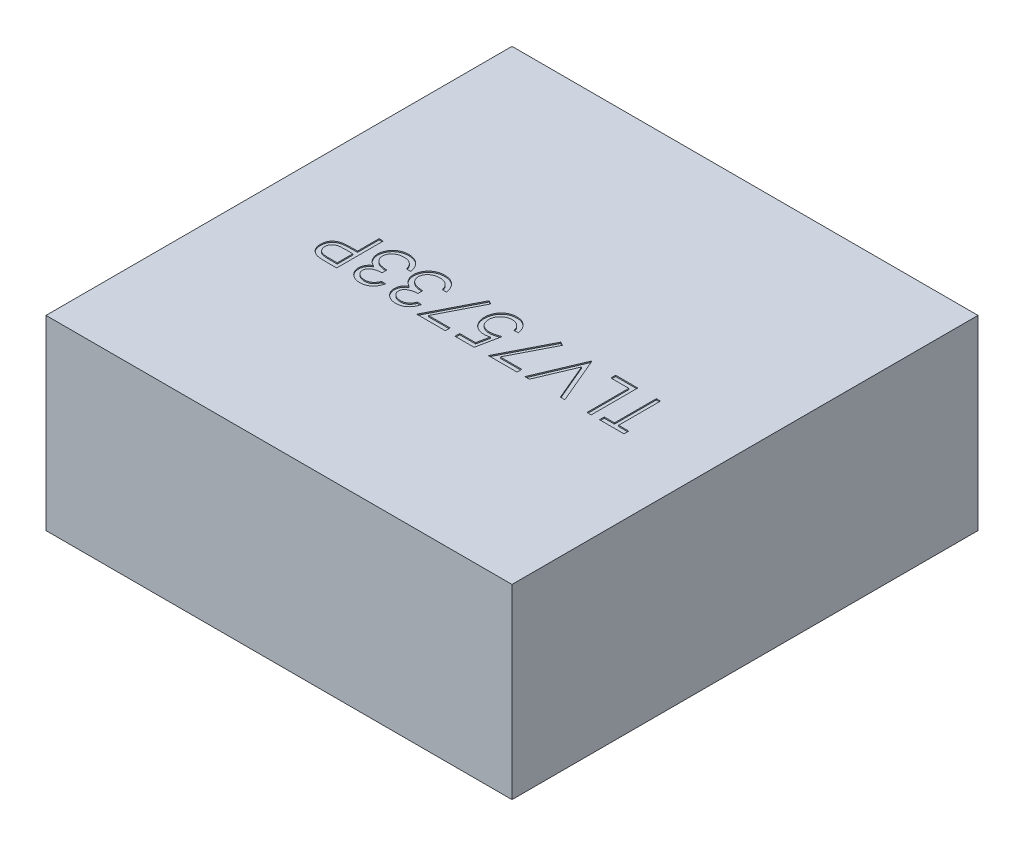
from build123d import *

# Parameters (mm, degrees)
BASES_W          = 2
BASES_H          = 2
BASE_DEPTH       = 0.8
PARTNUMBER_DEPTH = 0.005


with BuildPart() as part:
    # BaseS → Base (new body)
    with BuildSketch(Plane(origin=(0, 0, 0), x_dir=(1, 0, 0), z_dir=(0, 1, 0))):
        Rectangle(BASES_W, BASES_H)
    extrude(amount=BASE_DEPTH)

    # PartNumberS → PartNumber (cut)
    # profile 1 of 9: a face of its own
    with BuildSketch(Plane(origin=(0, 0.8, 0), x_dir=(1, 0, 0), z_dir=(0, 1, 0))):
        Polygon((0.680769231, -0.179487179), (0.680769231, -0.2), (0.575641026, -0.2), (0.575641026, -0.179487179), (0.619230769, -0.179487179), (0.619230769, 0), (0.637179487, 0), (0.637179487, -0.179487179), align=None)
    # profile 2 of 9: a face of its own
    with BuildSketch(Plane(origin=(0, 0.8, 0), x_dir=(1, 0, 0), z_dir=(0, 1, 0))):
        Polygon((0.53974359, -0.2), (0.521794872, -0.2), (0.521794872, -0.020512821), (0.444871795, -0.020512821), (0.444871795, 0), (0.53974359, 0), align=None)
    # profile 3 of 9: a face of its own
    with BuildSketch(Plane(origin=(0, 0.8, 0), x_dir=(1, 0, 0), z_dir=(0, 1, 0))):
        Polygon((0.426923077, -0.2), (0.407692308, -0.2), (0.341025641, -0.042387821), (0.274358974, -0.2), (0.255128205, -0.2), (0.33974359, 0), (0.342307692, 0), align=None)
    # profile 4 of 9: a face of its own
    with BuildSketch(Plane(origin=(0, 0.8, 0), x_dir=(1, 0, 0), z_dir=(0, 1, 0))):
        Polygon((0.221794872, -0.2), (0.098717949, -0.2), (0.203846154, 0.005128205), (0.219350962, -0.003405449), (0.129086538, -0.179487179), (0.221794872, -0.179487179), align=None)
    # profile 5 of 9: a face of its own
    with BuildSketch(Plane(origin=(0, 0.8, 0), x_dir=(1, 0, 0), z_dir=(0, 1, 0))):
        with BuildLine():
            Line((-0.044871795, -0.2), (-0.044871795, -0.179487179))
            Line((-0.044871795, -0.179487179), (0.023157051, -0.179487179))
            Line((0.023157051, -0.179487179), (0.033934295, -0.126883013))
            add(Edge.make_bspline(
                [(0.033934295, -0.126883013), (0.031816816, -0.1274676), (0.027714537, -0.128600145), (0.021659687, -0.129857617), (0.015911561, -0.130615643), (0.01218154, -0.130719146), (0.010376603, -0.130769231)],
                knots=[0, 0, 0, 0, 1.100273476, 2.13160584, 3.095893838, 4, 4, 4, 4], degree=3))
            add(Edge.make_bspline(
                [(0.010376603, -0.130769231), (0.008142844, -0.130722475), (0.003750716, -0.130630542), (-0.00266564, -0.129695799), (-0.00882109, -0.128340984), (-0.014627096, -0.126257022), (-0.020177264, -0.12369573), (-0.025396346, -0.120511598), (-0.030308859, -0.116749998), (-0.034904064, -0.112488094), (-0.039046803, -0.107742932), (-0.04266112, -0.102636713), (-0.045750495, -0.097226416), (-0.048214901, -0.091462275), (-0.050212995, -0.085398611), (-0.051534137, -0.078984544), (-0.052415598, -0.072273437), (-0.05251395, -0.067684575), (-0.052564103, -0.065344551)],
                knots=[0, 0, 0, 0, 1.052656913, 2.069786496, 3.052102726, 4.020122636, 4.972424848, 5.930457368, 6.896570172, 7.885826804, 8.881139003, 9.861434336, 10.831623367, 11.813212553, 12.812997731, 13.836986694, 14.897002833, 16, 16, 16, 16], degree=3))
            add(Edge.make_bspline(
                [(-0.052564103, -0.065344551), (-0.052526069, -0.063714718), (-0.052450516, -0.060477078), (-0.052067024, -0.05566872), (-0.051326252, -0.050962711), (-0.050342361, -0.046368373), (-0.049034062, -0.041878849), (-0.047486935, -0.037483546), (-0.045635127, -0.033189737), (-0.043521961, -0.029018787), (-0.041117733, -0.02505279), (-0.038551881, -0.021245534), (-0.035755993, -0.017707472), (-0.032779013, -0.014379465), (-0.029563779, -0.011357231), (-0.026189195, -0.008514697), (-0.022579797, -0.005972433), (-0.018799216, -0.00363428), (-0.014850105, -0.001540748), (-0.010692348, 0.000205622), (-0.006417238, 0.001736333), (-0.001986665, 0.002981114), (0.002590784, 0.003946885), (0.007330874, 0.004604561), (0.01220982, 0.005083078), (0.015516956, 0.00511306), (0.0171875, 0.005128205)],
                knots=[0, 0, 0, 0, 1.056281413, 2.098288097, 3.122646807, 4.141030392, 5.140675379, 6.150604744, 7.15845591, 8.168533554, 9.177684096, 10.161739049, 11.141561652, 12.097360316, 13.052218386, 13.998410789, 14.954052752, 15.909851415, 16.877523809, 17.846742625, 18.829312613, 19.818263486, 20.826374662, 21.858017533, 22.918014209, 24, 24, 24, 24], degree=3))
            add(Edge.make_bspline(
                [(0.0171875, 0.005128205), (0.019180257, 0.005088619), (0.023100771, 0.005010738), (0.028845563, 0.004199816), (0.034369338, 0.003030456), (0.039649185, 0.001298915), (0.044660275, -0.000971722), (0.049475299, -0.003652227), (0.054006118, -0.006887491), (0.058284876, -0.010561531), (0.062209915, -0.014636501), (0.065823355, -0.018968808), (0.068952141, -0.023654541), (0.071670748, -0.028615525), (0.073983404, -0.033864696), (0.075801821, -0.039414236), (0.077269041, -0.045237188), (0.077889824, -0.049245947), (0.078205128, -0.051282051)],
                knots=[0, 0, 0, 0, 1.04695683, 2.059763882, 3.044413726, 4.012427942, 4.974081556, 5.932886124, 6.904940154, 7.895678616, 8.893654631, 9.876199664, 10.857615262, 11.850515636, 12.847107701, 13.868396357, 14.917328757, 16, 16, 16, 16], degree=3))
            Line((0.078205128, -0.051282051), (0.06025641, -0.051282051))
            add(Edge.make_bspline(
                [(0.06025641, -0.051282051), (0.059815333, -0.049374443), (0.058967558, -0.045707913), (0.057096993, -0.040562644), (0.054846086, -0.03595852), (0.052045418, -0.031924495), (0.04886416, -0.028324783), (0.045192472, -0.025123656), (0.041061558, -0.022270508), (0.036470494, -0.019872837), (0.031614568, -0.017856105), (0.026561981, -0.016416181), (0.021384479, -0.015544733), (0.017898621, -0.015438189), (0.016145833, -0.015384615)],
                knots=[0, 0, 0, 0, 1.136370375, 2.184166959, 3.172867797, 4.104539607, 5.027679118, 5.956634301, 6.927059835, 7.936867459, 8.959641981, 9.976160943, 10.98235693, 12, 12, 12, 12], degree=3))
            add(Edge.make_bspline(
                [(0.016145833, -0.015384615), (0.014434067, -0.015431909), (0.011063586, -0.015525032), (0.006100853, -0.016230204), (0.001323524, -0.017344777), (-0.00327688, -0.01890623), (-0.007677755, -0.02097194), (-0.011872877, -0.023509547), (-0.01592201, -0.026455739), (-0.019718587, -0.029823128), (-0.023194943, -0.033536101), (-0.026266769, -0.037506128), (-0.028825438, -0.041741405), (-0.030981676, -0.046168435), (-0.032619006, -0.050835783), (-0.033787063, -0.055721564), (-0.034472952, -0.060837848), (-0.034567305, -0.064327523), (-0.034615385, -0.066105769)],
                knots=[0, 0, 0, 0, 1.027268864, 2.022700798, 3.002744649, 3.968653148, 4.933396556, 5.915045722, 6.907600446, 7.935526002, 8.956456544, 9.95700807, 10.942805781, 11.92166854, 12.907987664, 13.905483474, 14.932689774, 16, 16, 16, 16], degree=3))
            add(Edge.make_bspline(
                [(-0.034615385, -0.066105769), (-0.034584995, -0.067711261), (-0.034525727, -0.070842346), (-0.033824813, -0.075418974), (-0.032880736, -0.079787618), (-0.031391757, -0.08390746), (-0.029583182, -0.087821511), (-0.027226683, -0.091433059), (-0.024621421, -0.094918694), (-0.021501441, -0.098047976), (-0.018123222, -0.100960292), (-0.014379546, -0.103430346), (-0.010377398, -0.105531902), (-0.006107453, -0.107253498), (-0.00156497, -0.108624951), (0.003252642, -0.109572763), (0.00834644, -0.110139924), (0.011830763, -0.110216862), (0.013621795, -0.11025641)],
                knots=[0, 0, 0, 0, 1.045820996, 2.039596555, 3.013371638, 3.9552447, 4.890047302, 5.817684688, 6.761648481, 7.722253242, 8.692244539, 9.66551337, 10.63924952, 11.635311376, 12.662847378, 13.728455105, 14.832366986, 16, 16, 16, 16], degree=3))
            add(Edge.make_bspline(
                [(0.013621795, -0.11025641), (0.015185482, -0.11022436), (0.018386592, -0.110158749), (0.023308293, -0.109642401), (0.028457756, -0.108848049), (0.033854972, -0.107703134), (0.03948513, -0.106269622), (0.045357593, -0.104479345), (0.051472502, -0.102417172), (0.055588274, -0.10081768), (0.057692308, -0.1)],
                knots=[0, 0, 0, 0, 0.824638674, 1.688163388, 2.607705698, 3.571998603, 4.597075385, 5.671199175, 6.809488238, 8, 8, 8, 8], degree=3))
            Line((0.057692308, -0.1), (0.037179487, -0.2))
            Line((0.037179487, -0.2), (-0.044871795, -0.2))
        make_face()
    # profile 6 of 9: a face of its own
    with BuildSketch(Plane(origin=(0, 0.8, 0), x_dir=(1, 0, 0), z_dir=(0, 1, 0))):
        Polygon((-0.085897436, -0.2), (-0.208974359, -0.2), (-0.103846154, 0.005128205), (-0.088341346, -0.003405449), (-0.178605769, -0.179487179), (-0.085897436, -0.179487179), align=None)
    # profile 7 of 9: a face of its own
    with BuildSketch(Plane(origin=(0, 0.8, 0), x_dir=(1, 0, 0), z_dir=(0, 1, 0))):
        with BuildLine():
            Line((-0.252564103, -0.153846154), (-0.234615385, -0.153846154))
            add(Edge.make_bspline(
                [(-0.234615385, -0.153846154), (-0.235101645, -0.155859439), (-0.236052243, -0.159795246), (-0.238034962, -0.165418518), (-0.240194919, -0.170739862), (-0.242788582, -0.175659638), (-0.245617654, -0.180276718), (-0.248858952, -0.184486382), (-0.252362936, -0.188395694), (-0.256238648, -0.191865022), (-0.260303143, -0.195006607), (-0.264613693, -0.197685181), (-0.269083572, -0.199989419), (-0.273743751, -0.201887718), (-0.278608104, -0.203317748), (-0.283632654, -0.204355279), (-0.288830568, -0.205029057), (-0.292359002, -0.205094815), (-0.294150641, -0.205128205)],
                knots=[0, 0, 0, 0, 1.162005537, 2.271625781, 3.343758855, 4.383309926, 5.390229558, 6.379919256, 7.361854164, 8.333198761, 9.295911338, 10.242430842, 11.177959212, 12.116337295, 13.062827104, 14.020064771, 14.994644689, 16, 16, 16, 16], degree=3))
            add(Edge.make_bspline(
                [(-0.294150641, -0.205128205), (-0.296761083, -0.205049392), (-0.301925027, -0.204893485), (-0.309511487, -0.203469803), (-0.316827305, -0.201216938), (-0.323792405, -0.198104154), (-0.33026203, -0.194264879), (-0.336018383, -0.189695465), (-0.340983441, -0.184484076), (-0.345148834, -0.17872793), (-0.348410262, -0.172576186), (-0.350815198, -0.166244749), (-0.352279294, -0.159748636), (-0.35246904, -0.155362506), (-0.352564103, -0.153165064)],
                knots=[0, 0, 0, 0, 1.083050992, 2.142477498, 3.193116406, 4.255571735, 5.30263384, 6.308962982, 7.297363603, 8.282367274, 9.249857812, 10.179914175, 11.08814088, 12, 12, 12, 12], degree=3))
            add(Edge.make_bspline(
                [(-0.352564103, -0.153165064), (-0.352497612, -0.15105039), (-0.352367499, -0.146912301), (-0.351262716, -0.140871073), (-0.349403501, -0.135177267), (-0.346828086, -0.129806915), (-0.343494283, -0.124794067), (-0.339455843, -0.120127445), (-0.334684263, -0.11578635), (-0.331068323, -0.113299523), (-0.329206731, -0.112019231)],
                knots=[0, 0, 0, 0, 1.024540389, 2.004866551, 2.965041327, 3.920577974, 4.882998113, 5.874504559, 6.905732034, 8, 8, 8, 8], degree=3))
            add(Edge.make_bspline(
                [(-0.329206731, -0.112019231), (-0.331336971, -0.110995631), (-0.335564434, -0.108964297), (-0.341268516, -0.104917242), (-0.346525572, -0.100359254), (-0.349422874, -0.096762548), (-0.35088141, -0.094951923)],
                knots=[0, 0, 0, 0, 1.015663554, 2.015584519, 3.001021554, 4, 4, 4, 4], degree=3))
            add(Edge.make_bspline(
                [(-0.35088141, -0.094951923), (-0.351844164, -0.093634478), (-0.353753907, -0.091021161), (-0.3561045, -0.086817028), (-0.358261328, -0.082580215), (-0.35984869, -0.078144135), (-0.361218522, -0.073651284), (-0.362119825, -0.069005451), (-0.362698426, -0.064250776), (-0.362779673, -0.061032679), (-0.362820513, -0.059415064)],
                knots=[0, 0, 0, 0, 1.02516404, 2.033540309, 3.025129118, 4.011046665, 4.991655828, 5.976607087, 6.982917762, 8, 8, 8, 8], degree=3))
            add(Edge.make_bspline(
                [(-0.362820513, -0.059415064), (-0.362717729, -0.056614634), (-0.362512644, -0.051026954), (-0.360687448, -0.04276937), (-0.357840373, -0.034712452), (-0.353872501, -0.026970463), (-0.348941038, -0.019748905), (-0.343106446, -0.013268976), (-0.336362512, -0.007749819), (-0.328905592, -0.003097513), (-0.320795508, 0.000589387), (-0.312155603, 0.003246097), (-0.30303703, 0.00483975), (-0.29680125, 0.005030959), (-0.293629808, 0.005128205)],
                knots=[0, 0, 0, 0, 0.955619592, 1.906742024, 2.874954321, 3.868585453, 4.869520953, 5.854611167, 6.836527075, 7.836578462, 8.849204403, 9.870874567, 10.917152508, 12, 12, 12, 12], degree=3))
            add(Edge.make_bspline(
                [(-0.293629808, 0.005128205), (-0.291491697, 0.00507816), (-0.287284607, 0.004979689), (-0.281097347, 0.004318503), (-0.275203834, 0.003078069), (-0.269546838, 0.001518053), (-0.264211739, -0.000638844), (-0.259121794, -0.003210266), (-0.254299316, -0.006262151), (-0.249772943, -0.009799634), (-0.245547511, -0.013759317), (-0.241730671, -0.018206982), (-0.238280192, -0.023059619), (-0.235218, -0.02836088), (-0.232531206, -0.034095915), (-0.23027763, -0.040287707), (-0.228309979, -0.046888254), (-0.227393366, -0.051486777), (-0.226923077, -0.053846154)],
                knots=[0, 0, 0, 0, 1.048603596, 2.063302207, 3.045874044, 3.999447474, 4.937100059, 5.862643889, 6.7929026, 7.7308982, 8.676022965, 9.627908155, 10.600123445, 11.591992905, 12.626222643, 13.701663232, 14.820785756, 16, 16, 16, 16], degree=3))
            Line((-0.226923077, -0.053846154), (-0.244871795, -0.053846154))
            add(Edge.make_bspline(
                [(-0.244871795, -0.053846154), (-0.245339412, -0.05230621), (-0.246248967, -0.049310886), (-0.247797212, -0.045000012), (-0.249561113, -0.041048123), (-0.251453374, -0.03742623), (-0.253440714, -0.034098664), (-0.255664424, -0.031153415), (-0.257959803, -0.028461117), (-0.259690052, -0.026944282), (-0.260536859, -0.026201923)],
                knots=[0, 0, 0, 0, 1.198163088, 2.33053128, 3.407730985, 4.417276592, 5.372219308, 6.28897303, 7.162600585, 8, 8, 8, 8], degree=3))
            add(Edge.make_bspline(
                [(-0.260536859, -0.026201923), (-0.261656788, -0.025338946), (-0.26389319, -0.023615655), (-0.267535212, -0.021410219), (-0.271378905, -0.019522419), (-0.275456321, -0.017987935), (-0.27976801, -0.016836097), (-0.284296479, -0.016007058), (-0.28904916, -0.015459763), (-0.292292772, -0.01541003), (-0.293950321, -0.015384615)],
                knots=[0, 0, 0, 0, 0.946083416, 1.889246487, 2.84504177, 3.809995578, 4.801312957, 5.829064617, 6.89060985, 8, 8, 8, 8], degree=3))
            add(Edge.make_bspline(
                [(-0.293950321, -0.015384615), (-0.295821975, -0.015419753), (-0.299481833, -0.015488461), (-0.304821756, -0.016122158), (-0.309903447, -0.017041039), (-0.314675045, -0.018478347), (-0.319201481, -0.020202635), (-0.323381711, -0.022460045), (-0.32733863, -0.025009425), (-0.330956317, -0.027974844), (-0.334217839, -0.031180141), (-0.337036154, -0.034580675), (-0.339477138, -0.038071008), (-0.341439281, -0.041732562), (-0.342991429, -0.045529421), (-0.344047428, -0.049475795), (-0.344781849, -0.053538455), (-0.344841649, -0.056300116), (-0.344871795, -0.057692308)],
                knots=[0, 0, 0, 0, 1.216990249, 2.379719373, 3.493992396, 4.571561497, 5.616923107, 6.638958652, 7.655775068, 8.674704564, 9.676001865, 10.625896028, 11.54399481, 12.441854662, 13.322657739, 14.20572845, 15.095482574, 16, 16, 16, 16], degree=3))
            add(Edge.make_bspline(
                [(-0.344871795, -0.057692308), (-0.344784167, -0.059555696), (-0.344609346, -0.0632732), (-0.34328016, -0.068744529), (-0.341074286, -0.074018171), (-0.338046202, -0.079025064), (-0.334271747, -0.083611196), (-0.32992934, -0.08771628), (-0.324926328, -0.091134393), (-0.32029549, -0.093489428), (-0.316182981, -0.095058495), (-0.31267069, -0.096158774), (-0.308735058, -0.097038296), (-0.304423376, -0.097889066), (-0.299717445, -0.098602295), (-0.29461303, -0.099199653), (-0.289108075, -0.099676883), (-0.285297159, -0.099890117), (-0.283333333, -0.1)],
                knots=[0, 0, 0, 0, 1.070440979, 2.135555593, 3.216243406, 4.345886539, 5.486149072, 6.621334998, 7.769144672, 8.957074012, 9.598644492, 10.297969361, 11.070758978, 11.915404831, 12.824182859, 13.805940418, 14.869366021, 16, 16, 16, 16], degree=3))
            Line((-0.283333333, -0.1), (-0.283333333, -0.120512821))
            add(Edge.make_bspline(
                [(-0.283333333, -0.120512821), (-0.285806723, -0.120561043), (-0.290649793, -0.120655467), (-0.297744165, -0.12156233), (-0.304507319, -0.123034295), (-0.310837527, -0.125089351), (-0.316577441, -0.127591218), (-0.321604791, -0.130392354), (-0.325738717, -0.133623909), (-0.329053258, -0.137133123), (-0.33151169, -0.140920736), (-0.333326358, -0.144850479), (-0.334399697, -0.148995461), (-0.334543235, -0.151823627), (-0.334615385, -0.153245192)],
                knots=[0, 0, 0, 0, 1.321816535, 2.58820849, 3.816448615, 5.017641336, 6.139869627, 7.160068286, 8.085608132, 8.934319198, 9.728416342, 10.48890201, 11.240453369, 12, 12, 12, 12], degree=3))
            add(Edge.make_bspline(
                [(-0.334615385, -0.153245192), (-0.334592225, -0.154289811), (-0.33454615, -0.156368031), (-0.333941878, -0.159413745), (-0.333075802, -0.162366392), (-0.331817567, -0.165191473), (-0.330190288, -0.167897968), (-0.328221523, -0.170495763), (-0.325906283, -0.173009663), (-0.323259606, -0.175384225), (-0.320305845, -0.177521373), (-0.317163555, -0.179426611), (-0.313820484, -0.181028645), (-0.310298418, -0.182356622), (-0.30657832, -0.183353822), (-0.302679758, -0.184070288), (-0.29859472, -0.184518117), (-0.295807768, -0.184582603), (-0.294391026, -0.184615385)],
                knots=[0, 0, 0, 0, 0.884246871, 1.759167212, 2.622361933, 3.489113179, 4.372562419, 5.294145153, 6.247651513, 7.265905295, 8.30305477, 9.334068495, 10.37719476, 11.441246459, 12.52060732, 13.637552802, 14.799054011, 16, 16, 16, 16], degree=3))
            add(Edge.make_bspline(
                [(-0.294391026, -0.184615385), (-0.292113712, -0.184536032), (-0.287665589, -0.184381039), (-0.281254357, -0.183018718), (-0.275300401, -0.180860261), (-0.270764688, -0.178253931), (-0.267409674, -0.17569), (-0.264966247, -0.17348425), (-0.262610533, -0.170983381), (-0.260434973, -0.168118798), (-0.258309201, -0.164989002), (-0.256253517, -0.161576754), (-0.254333949, -0.157833407), (-0.253165476, -0.155200978), (-0.252564103, -0.153846154)],
                knots=[0, 0, 0, 0, 1.4727372, 2.876598283, 4.222346151, 5.558423782, 6.24313385, 6.953189256, 7.68715613, 8.463578749, 9.278833271, 10.135787152, 11.040551781, 12, 12, 12, 12], degree=3))
        make_face()
    # profile 8 of 9: a face of its own
    with BuildSketch(Plane(origin=(0, 0.8, 0), x_dir=(1, 0, 0), z_dir=(0, 1, 0))):
        with BuildLine():
            Line((-0.406410256, -0.153846154), (-0.388461538, -0.153846154))
            add(Edge.make_bspline(
                [(-0.388461538, -0.153846154), (-0.388947799, -0.155859439), (-0.389898397, -0.159795246), (-0.391881116, -0.165418518), (-0.394041073, -0.170739862), (-0.396634736, -0.175659638), (-0.399463808, -0.180276718), (-0.402705106, -0.184486382), (-0.40620909, -0.188395694), (-0.410084802, -0.191865022), (-0.414149297, -0.195006607), (-0.418459846, -0.197685181), (-0.422929726, -0.199989419), (-0.427589905, -0.201887718), (-0.432454258, -0.203317748), (-0.437478808, -0.204355279), (-0.442676722, -0.205029057), (-0.446205156, -0.205094815), (-0.447996795, -0.205128205)],
                knots=[0, 0, 0, 0, 1.162005537, 2.271625781, 3.343758855, 4.383309926, 5.390229558, 6.379919256, 7.361854164, 8.333198761, 9.295911338, 10.242430842, 11.177959212, 12.116337295, 13.062827104, 14.020064771, 14.994644689, 16, 16, 16, 16], degree=3))
            add(Edge.make_bspline(
                [(-0.447996795, -0.205128205), (-0.450607237, -0.205049392), (-0.455771181, -0.204893485), (-0.463357641, -0.203469803), (-0.470673459, -0.201216938), (-0.477638559, -0.198104154), (-0.484108183, -0.194264879), (-0.489864537, -0.189695465), (-0.494829595, -0.184484076), (-0.498994988, -0.17872793), (-0.502256416, -0.172576186), (-0.504661352, -0.166244749), (-0.506125448, -0.159748636), (-0.506315194, -0.155362506), (-0.506410256, -0.153165064)],
                knots=[0, 0, 0, 0, 1.083050992, 2.142477498, 3.193116406, 4.255571735, 5.30263384, 6.308962982, 7.297363603, 8.282367274, 9.249857812, 10.179914175, 11.08814088, 12, 12, 12, 12], degree=3))
            add(Edge.make_bspline(
                [(-0.506410256, -0.153165064), (-0.506343765, -0.15105039), (-0.506213653, -0.146912301), (-0.50510887, -0.140871073), (-0.503249655, -0.135177267), (-0.50067424, -0.129806915), (-0.497340437, -0.124794067), (-0.493301997, -0.120127445), (-0.488530417, -0.11578635), (-0.484914477, -0.113299523), (-0.483052885, -0.112019231)],
                knots=[0, 0, 0, 0, 1.024540389, 2.004866551, 2.965041327, 3.920577974, 4.882998113, 5.874504559, 6.905732034, 8, 8, 8, 8], degree=3))
            add(Edge.make_bspline(
                [(-0.483052885, -0.112019231), (-0.485183125, -0.110995631), (-0.489410588, -0.108964297), (-0.49511467, -0.104917242), (-0.500371726, -0.100359254), (-0.503269028, -0.096762548), (-0.504727564, -0.094951923)],
                knots=[0, 0, 0, 0, 1.015663554, 2.015584519, 3.001021554, 4, 4, 4, 4], degree=3))
            add(Edge.make_bspline(
                [(-0.504727564, -0.094951923), (-0.505690318, -0.093634478), (-0.507600061, -0.091021161), (-0.509950654, -0.086817028), (-0.512107482, -0.082580215), (-0.513694844, -0.078144135), (-0.515064675, -0.073651284), (-0.515965979, -0.069005451), (-0.516544579, -0.064250776), (-0.516625827, -0.061032679), (-0.516666667, -0.059415064)],
                knots=[0, 0, 0, 0, 1.02516404, 2.033540309, 3.025129118, 4.011046665, 4.991655828, 5.976607087, 6.982917762, 8, 8, 8, 8], degree=3))
            add(Edge.make_bspline(
                [(-0.516666667, -0.059415064), (-0.516563882, -0.056614634), (-0.516358798, -0.051026954), (-0.514533602, -0.04276937), (-0.511686526, -0.034712452), (-0.507718655, -0.026970463), (-0.502787192, -0.019748905), (-0.496952599, -0.013268976), (-0.490208666, -0.007749819), (-0.482751746, -0.003097513), (-0.474641662, 0.000589387), (-0.466001757, 0.003246097), (-0.456883184, 0.00483975), (-0.450647404, 0.005030959), (-0.447475962, 0.005128205)],
                knots=[0, 0, 0, 0, 0.955619592, 1.906742024, 2.874954321, 3.868585453, 4.869520953, 5.854611167, 6.836527075, 7.836578462, 8.849204403, 9.870874567, 10.917152508, 12, 12, 12, 12], degree=3))
            add(Edge.make_bspline(
                [(-0.447475962, 0.005128205), (-0.44533785, 0.00507816), (-0.441130761, 0.004979689), (-0.434943501, 0.004318503), (-0.429049988, 0.003078069), (-0.423392992, 0.001518053), (-0.418057892, -0.000638844), (-0.412967948, -0.003210266), (-0.40814547, -0.006262151), (-0.403619097, -0.009799634), (-0.399393665, -0.013759317), (-0.395576825, -0.018206982), (-0.392126346, -0.023059619), (-0.389064154, -0.02836088), (-0.386377359, -0.034095915), (-0.384123783, -0.040287707), (-0.382156133, -0.046888254), (-0.38123952, -0.051486777), (-0.380769231, -0.053846154)],
                knots=[0, 0, 0, 0, 1.048603596, 2.063302207, 3.045874044, 3.999447474, 4.937100059, 5.862643889, 6.7929026, 7.7308982, 8.676022965, 9.627908155, 10.600123445, 11.591992905, 12.626222643, 13.701663232, 14.820785756, 16, 16, 16, 16], degree=3))
            Line((-0.380769231, -0.053846154), (-0.398717949, -0.053846154))
            add(Edge.make_bspline(
                [(-0.398717949, -0.053846154), (-0.399185565, -0.05230621), (-0.40009512, -0.049310886), (-0.401643366, -0.045000012), (-0.403407267, -0.041048123), (-0.405299528, -0.03742623), (-0.407286868, -0.034098664), (-0.409510578, -0.031153415), (-0.411805957, -0.028461117), (-0.413536206, -0.026944282), (-0.414383013, -0.026201923)],
                knots=[0, 0, 0, 0, 1.198163088, 2.33053128, 3.407730985, 4.417276592, 5.372219308, 6.28897303, 7.162600585, 8, 8, 8, 8], degree=3))
            add(Edge.make_bspline(
                [(-0.414383013, -0.026201923), (-0.415502942, -0.025338946), (-0.417739344, -0.023615655), (-0.421381366, -0.021410219), (-0.425225058, -0.019522419), (-0.429302475, -0.017987935), (-0.433614163, -0.016836097), (-0.438142633, -0.016007058), (-0.442895314, -0.015459763), (-0.446138926, -0.01541003), (-0.447796474, -0.015384615)],
                knots=[0, 0, 0, 0, 0.946083416, 1.889246487, 2.84504177, 3.809995578, 4.801312957, 5.829064617, 6.89060985, 8, 8, 8, 8], degree=3))
            add(Edge.make_bspline(
                [(-0.447796474, -0.015384615), (-0.449668128, -0.015419753), (-0.453327986, -0.015488461), (-0.45866791, -0.016122158), (-0.4637496, -0.017041039), (-0.468521199, -0.018478347), (-0.473047634, -0.020202635), (-0.477227865, -0.022460045), (-0.481184783, -0.025009425), (-0.484802471, -0.027974844), (-0.488063993, -0.031180141), (-0.490882308, -0.034580675), (-0.493323292, -0.038071008), (-0.495285435, -0.041732562), (-0.496837582, -0.045529421), (-0.497893582, -0.049475795), (-0.498628003, -0.053538455), (-0.498687803, -0.056300116), (-0.498717949, -0.057692308)],
                knots=[0, 0, 0, 0, 1.216990249, 2.379719373, 3.493992396, 4.571561497, 5.616923107, 6.638958652, 7.655775068, 8.674704564, 9.676001865, 10.625896028, 11.54399481, 12.441854662, 13.322657739, 14.20572845, 15.095482574, 16, 16, 16, 16], degree=3))
            add(Edge.make_bspline(
                [(-0.498717949, -0.057692308), (-0.49863032, -0.059555696), (-0.4984555, -0.0632732), (-0.497126314, -0.068744529), (-0.49492044, -0.074018171), (-0.491892356, -0.079025064), (-0.488117901, -0.083611196), (-0.483775494, -0.08771628), (-0.478772482, -0.091134393), (-0.474141643, -0.093489428), (-0.470029135, -0.095058495), (-0.466516843, -0.096158774), (-0.462581212, -0.097038296), (-0.458269529, -0.097889066), (-0.453563599, -0.098602295), (-0.448459183, -0.099199653), (-0.442954229, -0.099676883), (-0.439143313, -0.099890117), (-0.437179487, -0.1)],
                knots=[0, 0, 0, 0, 1.070440979, 2.135555593, 3.216243406, 4.345886539, 5.486149072, 6.621334998, 7.769144672, 8.957074012, 9.598644492, 10.297969361, 11.070758978, 11.915404831, 12.824182859, 13.805940418, 14.869366021, 16, 16, 16, 16], degree=3))
            Line((-0.437179487, -0.1), (-0.437179487, -0.120512821))
            add(Edge.make_bspline(
                [(-0.437179487, -0.120512821), (-0.439652877, -0.120561043), (-0.444495946, -0.120655467), (-0.451590319, -0.12156233), (-0.458353473, -0.123034295), (-0.464683681, -0.125089351), (-0.470423595, -0.127591218), (-0.475450945, -0.130392354), (-0.479584871, -0.133623909), (-0.482899412, -0.137133123), (-0.485357843, -0.140920736), (-0.487172512, -0.144850479), (-0.48824585, -0.148995461), (-0.488389389, -0.151823627), (-0.488461538, -0.153245192)],
                knots=[0, 0, 0, 0, 1.321816535, 2.58820849, 3.816448615, 5.017641336, 6.139869627, 7.160068286, 8.085608132, 8.934319198, 9.728416342, 10.48890201, 11.240453369, 12, 12, 12, 12], degree=3))
            add(Edge.make_bspline(
                [(-0.488461538, -0.153245192), (-0.488438379, -0.154289811), (-0.488392304, -0.156368031), (-0.487788032, -0.159413745), (-0.486921955, -0.162366392), (-0.485663721, -0.165191473), (-0.484036442, -0.167897968), (-0.482067676, -0.170495763), (-0.479752437, -0.173009663), (-0.477105759, -0.175384225), (-0.474151999, -0.177521373), (-0.471009709, -0.179426611), (-0.467666638, -0.181028645), (-0.464144572, -0.182356622), (-0.460424474, -0.183353822), (-0.456525912, -0.184070288), (-0.452440874, -0.184518117), (-0.449653922, -0.184582603), (-0.448237179, -0.184615385)],
                knots=[0, 0, 0, 0, 0.884246871, 1.759167212, 2.622361933, 3.489113179, 4.372562419, 5.294145153, 6.247651513, 7.265905295, 8.30305477, 9.334068495, 10.37719476, 11.441246459, 12.52060732, 13.637552802, 14.799054011, 16, 16, 16, 16], degree=3))
            add(Edge.make_bspline(
                [(-0.448237179, -0.184615385), (-0.445959866, -0.184536032), (-0.441511743, -0.184381039), (-0.435100511, -0.183018718), (-0.429146555, -0.180860261), (-0.424610842, -0.178253931), (-0.421255828, -0.17569), (-0.418812401, -0.17348425), (-0.416456687, -0.170983381), (-0.414281126, -0.168118798), (-0.412155355, -0.164989002), (-0.410099671, -0.161576754), (-0.408180103, -0.157833407), (-0.40701163, -0.155200978), (-0.406410256, -0.153846154)],
                knots=[0, 0, 0, 0, 1.4727372, 2.876598283, 4.222346151, 5.558423782, 6.24313385, 6.953189256, 7.68715613, 8.463578749, 9.278833271, 10.135787152, 11.040551781, 12, 12, 12, 12], degree=3))
        make_face()
    # profile 9 of 9: a face of its own
    with BuildSketch(Plane(origin=(0, 0.8, 0), x_dir=(1, 0, 0), z_dir=(0, 1, 0))):
        with BuildLine():
            Line((-0.552564103, -0.2), (-0.591786859, -0.2))
            add(Edge.make_bspline(
                [(-0.591786859, -0.2), (-0.594484625, -0.199997035), (-0.599653665, -0.199991352), (-0.607065954, -0.199819081), (-0.613797938, -0.199588985), (-0.619835103, -0.199270019), (-0.625196023, -0.198893071), (-0.62985644, -0.198364383), (-0.633852986, -0.197812366), (-0.63624764, -0.197251143), (-0.637339744, -0.196995192)],
                knots=[0, 0, 0, 0, 1.415646017, 2.712440637, 3.8905458, 4.950247383, 5.884950622, 6.709939814, 7.411656543, 8, 8, 8, 8], degree=3))
            add(Edge.make_bspline(
                [(-0.637339744, -0.196995192), (-0.638722222, -0.196616784), (-0.641454604, -0.195868883), (-0.645391933, -0.194371122), (-0.649137396, -0.192594385), (-0.652706657, -0.190572427), (-0.656038573, -0.188209761), (-0.659237172, -0.185642753), (-0.662235375, -0.182767587), (-0.664987909, -0.179588048), (-0.667538251, -0.176208296), (-0.669673071, -0.17254215), (-0.6715582, -0.16871679), (-0.673027298, -0.164638818), (-0.674182066, -0.160362064), (-0.675023085, -0.155875395), (-0.675563625, -0.151188492), (-0.675614916, -0.14798496), (-0.675641026, -0.146354167)],
                knots=[0, 0, 0, 0, 0.999333726, 1.975119402, 2.933498163, 3.889020618, 4.832249799, 5.779334906, 6.747801194, 7.724875447, 8.710438469, 9.696133548, 10.679360639, 11.681339199, 12.714023775, 13.766351759, 14.862936069, 16, 16, 16, 16], degree=3))
            add(Edge.make_bspline(
                [(-0.675641026, -0.146354167), (-0.675616944, -0.144709722), (-0.675569827, -0.141492256), (-0.675004325, -0.136785239), (-0.6742426, -0.132287046), (-0.67307134, -0.128007648), (-0.671537301, -0.123972462), (-0.669737756, -0.12011982), (-0.667567268, -0.116515267), (-0.665073278, -0.113145717), (-0.662298901, -0.110008008), (-0.659255876, -0.107124877), (-0.655956488, -0.104513201), (-0.652411222, -0.102167124), (-0.648585517, -0.100141051), (-0.644537394, -0.098326348), (-0.640231667, -0.096802287), (-0.637252095, -0.096000569), (-0.635737179, -0.095592949)],
                knots=[0, 0, 0, 0, 1.121902311, 2.195077645, 3.232258892, 4.234102512, 5.217864754, 6.176164875, 7.132989551, 8.084763148, 9.034132444, 9.988522005, 10.94243251, 11.903244335, 12.886203696, 13.894208494, 14.929344452, 16, 16, 16, 16], degree=3))
            add(Edge.make_bspline(
                [(-0.635737179, -0.095592949), (-0.634484175, -0.095326691), (-0.631738142, -0.094743172), (-0.627215984, -0.094087314), (-0.621948177, -0.093549438), (-0.615952644, -0.093047488), (-0.609215404, -0.092781517), (-0.601751909, -0.092469224), (-0.593536899, -0.09232187), (-0.587807186, -0.092312555), (-0.584815705, -0.092307692)],
                knots=[0, 0, 0, 0, 0.601372724, 1.317943291, 2.144091499, 3.08771165, 4.142394186, 5.309582461, 6.595334295, 8, 8, 8, 8], degree=3))
            Line((-0.584815705, -0.092307692), (-0.570512821, -0.092307692))
            Line((-0.570512821, -0.092307692), (-0.570512821, 0))
            Line((-0.570512821, 0), (-0.552564103, 0))
            Line((-0.552564103, 0), (-0.552564103, -0.2))
        make_face()
        with BuildLine():
            Line((-0.570512821, -0.179487179), (-0.570512821, -0.112820513))
            Line((-0.570512821, -0.112820513), (-0.605528846, -0.112379808))
            add(Edge.make_bspline(
                [(-0.605528846, -0.112379808), (-0.607238585, -0.11237868), (-0.610539201, -0.112376504), (-0.615319915, -0.112608136), (-0.619744637, -0.112860126), (-0.623819899, -0.113267653), (-0.627527101, -0.113764708), (-0.630875218, -0.114429274), (-0.633890971, -0.115107089), (-0.637364784, -0.116283217), (-0.641255819, -0.118057557), (-0.64547897, -0.120707753), (-0.649087306, -0.124046335), (-0.652183432, -0.127840667), (-0.654630707, -0.132066148), (-0.656404354, -0.136574615), (-0.657486952, -0.141348947), (-0.657623025, -0.144612418), (-0.657692308, -0.146274038)],
                knots=[0, 0, 0, 0, 1.160501667, 2.240324542, 3.248665471, 4.168823117, 5.020172044, 5.786515869, 6.485785279, 7.116517804, 8.272762037, 9.381837012, 10.485674779, 11.594342068, 12.695271952, 13.786226926, 14.872841088, 16, 16, 16, 16], degree=3))
            add(Edge.make_bspline(
                [(-0.657692308, -0.146274038), (-0.657619934, -0.147881827), (-0.657476064, -0.151077912), (-0.656413297, -0.155764279), (-0.654611924, -0.160221491), (-0.652181436, -0.164413482), (-0.649159505, -0.168197729), (-0.645622931, -0.171461906), (-0.641626739, -0.174103874), (-0.637938419, -0.175862608), (-0.634637664, -0.176893968), (-0.631784461, -0.177638558), (-0.628546512, -0.178152086), (-0.624954461, -0.178643436), (-0.621012906, -0.179040062), (-0.616696783, -0.179315492), (-0.61202047, -0.179474996), (-0.608774167, -0.17948302), (-0.607091346, -0.179487179)],
                knots=[0, 0, 0, 0, 1.12039168, 2.227199994, 3.330242575, 4.460839274, 5.593542475, 6.693949254, 7.801736126, 8.92216649, 9.528704869, 10.210659466, 10.975987387, 11.81211542, 12.738540127, 13.736887663, 14.826846554, 16, 16, 16, 16], degree=3))
            Line((-0.607091346, -0.179487179), (-0.570512821, -0.179487179))
        make_face(mode=Mode.SUBTRACT)
    extrude(amount=-PARTNUMBER_DEPTH, mode=Mode.SUBTRACT)


solid = part.part
